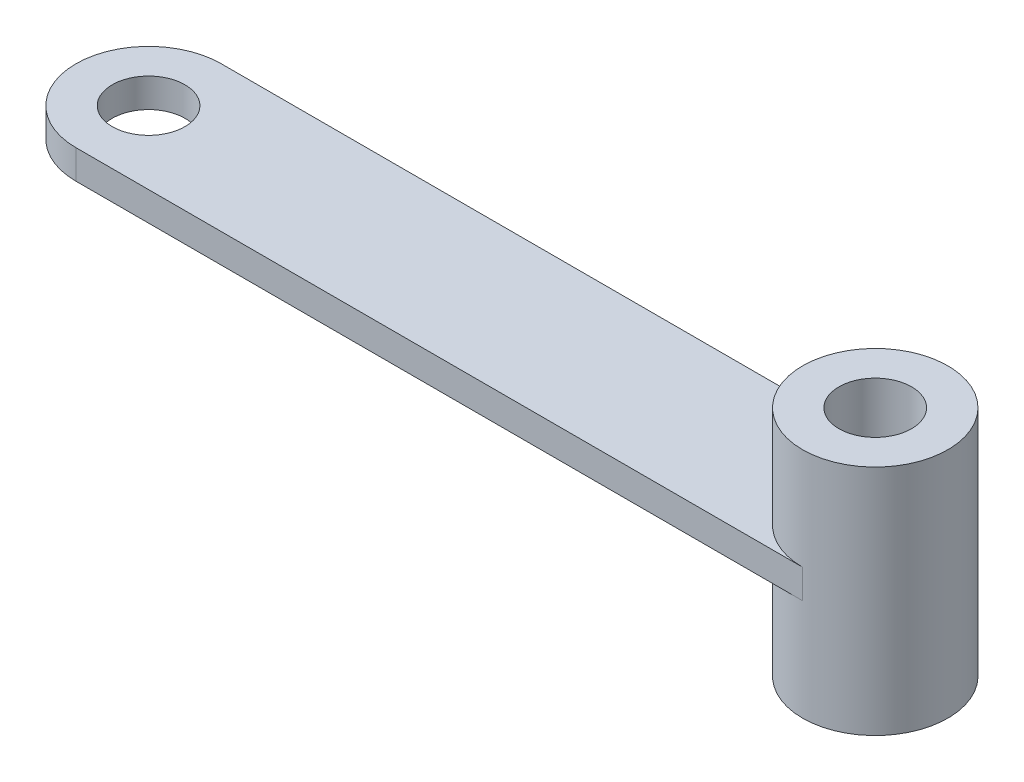
from build123d import *

# Parameters (mm, degrees)
SKETCH1_R                = 2.5
BOSS_EXTRUDE1_DEPTH      = 2
BOSS_EXTRUDE3_DEPTH      = 8
BOSS_EXTRUDE3_DEPTH_BACK = 8
SKETCH3_R                = 5
SKETCH3_R_2              = 2.5


with BuildPart() as part:
    # Sketch1 → Boss-Extrude1 (new body)
    with BuildSketch(Plane(origin=(0, 0, 0), x_dir=(1, 0, 0), z_dir=(0, 1, 0))):
        with BuildLine():
            Line((0, 5), (50, 5))
            ThreePointArc((50, 5), (55, 0), (50, -5))
            Line((50, -5), (0, -5))
            ThreePointArc((0, -5), (-5, 0), (0, 5))
        make_face()
        with Locations(Location((0, 0, 0), (0, 0, 270))):
            Circle(SKETCH1_R, mode=Mode.SUBTRACT)
        with Locations(Location((50, 0, 0), (0, 0, 270))):
            Circle(SKETCH1_R, mode=Mode.SUBTRACT)
    extrude(amount=BOSS_EXTRUDE1_DEPTH)

    # Sketch3 → Boss-Extrude3 (add, two sides: drawn at the far end of the back side and taken through both)
    with BuildSketch(Plane(origin=(0, 1, 0), x_dir=(1, 0, 0), z_dir=(0, 1, 0)).offset(-BOSS_EXTRUDE3_DEPTH_BACK)):
        with Locations(Location((50, 0, 0), (0, 0, 270))):
            Circle(SKETCH3_R)
        with Locations(Location((50, 0, 0), (0, 0, 270))):
            Circle(SKETCH3_R_2, mode=Mode.SUBTRACT)
    extrude(amount=BOSS_EXTRUDE3_DEPTH + BOSS_EXTRUDE3_DEPTH_BACK)


solid = part.part
